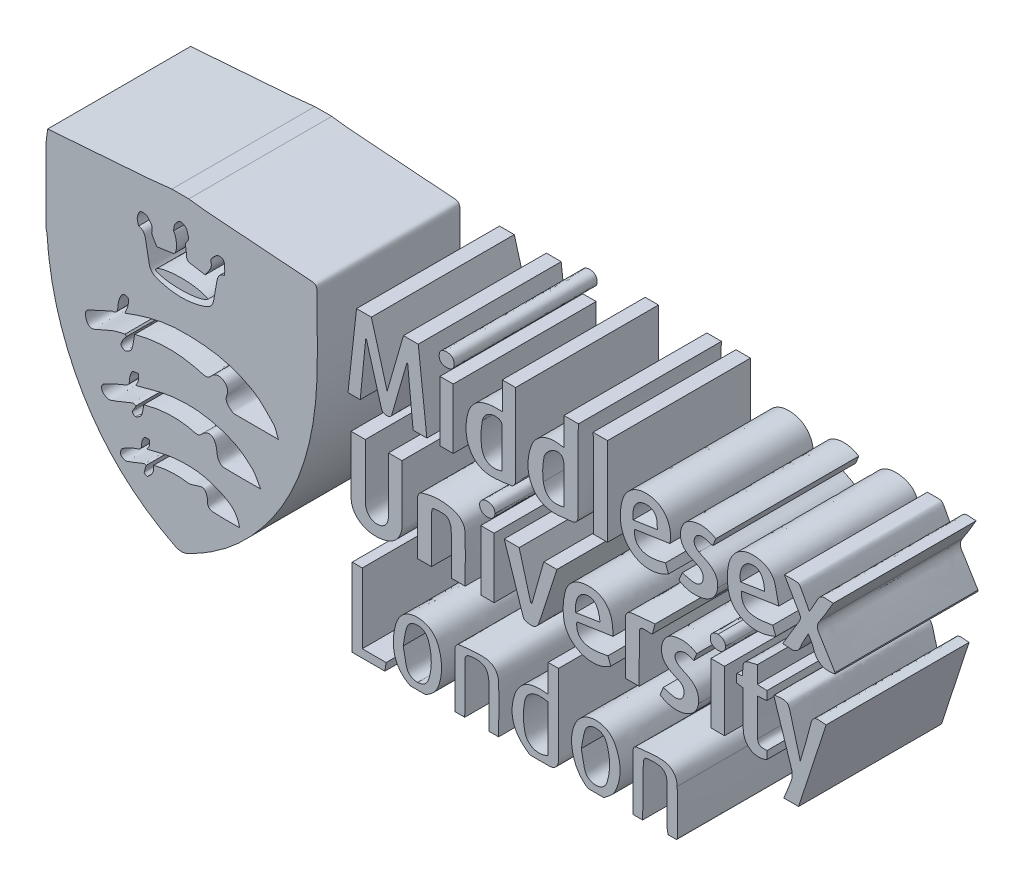
from build123d import *

# Parameters (mm, degrees)
BOSS_EXTRUDE1_DEPTH    = 10
BOSS_EXTRUDE1_2_DEPTH  = 10
BOSS_EXTRUDE1_3_DEPTH  = 10
BOSS_EXTRUDE1_4_DEPTH  = 10
BOSS_EXTRUDE1_5_DEPTH  = 10
BOSS_EXTRUDE1_6_DEPTH  = 10
BOSS_EXTRUDE1_7_DEPTH  = 10
BOSS_EXTRUDE1_8_DEPTH  = 10
BOSS_EXTRUDE1_9_DEPTH  = 10
BOSS_EXTRUDE1_10_DEPTH = 10
BOSS_EXTRUDE1_11_DEPTH = 10
BOSS_EXTRUDE1_12_DEPTH = 10
BOSS_EXTRUDE1_13_DEPTH = 10
BOSS_EXTRUDE1_14_DEPTH = 10
BOSS_EXTRUDE1_15_DEPTH = 10
BOSS_EXTRUDE1_16_DEPTH = 10
BOSS_EXTRUDE1_17_DEPTH = 10
BOSS_EXTRUDE1_18_DEPTH = 10
BOSS_EXTRUDE1_19_DEPTH = 10
BOSS_EXTRUDE1_20_DEPTH = 10
BOSS_EXTRUDE1_21_DEPTH = 10
BOSS_EXTRUDE1_22_DEPTH = 10
BOSS_EXTRUDE1_23_DEPTH = 10
BOSS_EXTRUDE1_24_DEPTH = 10
BOSS_EXTRUDE1_25_DEPTH = 10
BOSS_EXTRUDE1_26_DEPTH = 10
BOSS_EXTRUDE1_27_DEPTH = 10
BOSS_EXTRUDE1_28_DEPTH = 10
BOSS_EXTRUDE1_29_DEPTH = 10
BOSS_EXTRUDE1_30_DEPTH = 10


with BuildPart() as part:
    # Model → Boss-Extrude1 (new body)
    with BuildSketch(Plane.XY):
        with BuildLine():
            add(Edge.make_bspline(
                [(121.087444374, 108.853111084), (121.087444414, 110.574666531), (121.087444414, 112.296222302), (121.087444414, 114.017777749)],
                knots=[10, 10, 10, 10, 11, 11, 11, 11], degree=3))
            add(Edge.make_bspline(
                [(121.087444414, 114.017777749), (121.126156703, 114.316230139), (121.164868992, 114.61468261), (121.205362523, 114.926867447)],
                knots=[11, 11, 11, 11, 12, 12, 12, 12], degree=3))
            add(Edge.make_bspline(
                [(121.205362523, 114.926867447), (123.561551956, 115.102295934), (125.893613582, 115.272626542), (128.224986135, 115.451915845), (128.78209554, 115.4947592), (129.336908574, 115.567470433), (129.892777745, 115.626444426)],
                knots=[12, 12, 12, 12, 13, 13, 13, 14, 14, 14, 14], degree=3))
            add(Edge.make_bspline(
                [(129.892777745, 115.626444426), (130.287888641, 115.626444416), (130.683000183, 115.626444416), (131.078111078, 115.626444421)],
                knots=[14, 14, 14, 14, 15, 15, 15, 15], degree=3))
            add(Edge.make_bspline(
                [(121.087444374, 108.853111084), (121.114913637, 108.732908473), (121.159444188, 108.613807861), (121.167289538, 108.492337886), (121.28236394, 106.71063527), (121.608210592, 104.96879327), (122.205258613, 103.286198945), (123.64746354, 99.221791995), (126.193410528, 96.100176334), (130.07683111, 94.127703708), (130.40635234, 93.960332788), (130.68112239, 93.947318078), (131.026134277, 94.113996535), (132.764426752, 94.953785068), (134.273640832, 96.096502139), (135.568153548, 97.517801689), (138.532681898, 100.772685701), (139.848608035, 104.687118602), (140.035539777, 109.013749857), (140.114000104, 110.82971524), (140.037688225, 112.652159878), (140.044935844, 114.471606395), (140.046195457, 114.787715491), (139.953145581, 114.914672212), (139.618576856, 114.937674442), (137.228239556, 115.102014621), (134.839005548, 115.282789843), (132.450036381, 115.466338495), (131.991334406, 115.501581256), (131.535349319, 115.572164803), (131.078111078, 115.626444421)],
                knots=[43, 43, 43, 43, 44, 44, 44, 45, 45, 45, 46, 46, 46, 47, 47, 47, 48, 48, 48, 49, 49, 49, 50, 50, 50, 51, 51, 51, 52, 52, 52, 53, 53, 53, 53], degree=3))
        make_face()
        with BuildLine():
            add(Edge.make_bspline(
                [(134.626227838, 97.482675926), (134.502898156, 98.093903476), (134.227126875, 98.462578646), (133.619716923, 98.793776777), (132.505693191, 99.401212567), (131.296165598, 99.547906456), (130.058348388, 99.410245608), (129.442081741, 99.341708448), (128.839034571, 99.154301282), (128.149388036, 99.002975893)],
                knots=[0, 0, 0, 0, 1, 1, 1, 2, 2, 2, 3, 3, 3, 3], degree=3))
            add(Edge.make_bspline(
                [(128.149388036, 99.002975893), (128.229692566, 99.137785494), (128.308150309, 99.21763075), (128.323549886, 99.308197573), (128.343760539, 99.427061119), (128.314269445, 99.554375053), (128.306154307, 99.678054842)],
                knots=[3, 3, 3, 3, 4, 4, 4, 5, 5, 5, 5], degree=3))
            add(Edge.make_bspline(
                [(128.306154307, 99.678054842), (128.180658091, 99.653401308), (127.997254558, 99.670729708), (127.942303131, 99.594932009), (127.842726522, 99.457583804), (127.779322769, 99.265835818), (127.774677058, 99.094791995), (127.768512706, 98.867858818), (127.730835419, 98.758426221), (127.479122101, 98.682075584), (127.116650686, 98.572126223), (126.767712683, 98.392010602), (126.445350576, 98.190171501), (126.341930209, 98.125417056), (126.266324036, 97.865244306), (126.314377951, 97.752724042), (126.360900305, 97.643793999), (126.608489843, 97.523986066), (126.723153387, 97.558250125), (127.140589793, 97.682987989), (127.53770961, 97.874589989), (127.947119375, 98.028677483), (128.000979782, 98.048950147), (128.081671239, 97.997930005), (128.096948731, 97.993901828)],
                knots=[5, 5, 5, 5, 6, 6, 6, 7, 7, 7, 8, 8, 8, 9, 9, 9, 10, 10, 10, 11, 11, 11, 12, 12, 12, 13, 13, 13, 13], degree=3))
            add(Edge.make_bspline(
                [(128.096948731, 97.993901828), (128.03927977, 97.798570081), (127.977921112, 97.640900119), (127.957448202, 97.478088351), (127.953465887, 97.446413282), (128.15527269, 97.338873334), (128.182519089, 97.361639387), (128.32460021, 97.480355655), (128.472206833, 97.613489647), (128.556235942, 97.773903628), (128.621709335, 97.898893415), (128.596941467, 98.07115551), (128.615136093, 98.250608381)],
                knots=[13, 13, 13, 13, 14, 14, 14, 15, 15, 15, 16, 16, 16, 17, 17, 17, 17], degree=3))
            add(Edge.make_bspline(
                [(128.615136093, 98.250608381), (129.40301888, 98.460332013), (130.204298782, 98.523943118), (131.025103978, 98.385278455), (131.17666191, 98.359672783), (131.347807149, 98.448779747), (131.509696492, 98.485880842), (131.715678105, 98.533088554), (131.984793461, 98.68247866), (132.11123148, 98.603342664), (132.268621098, 98.504833173), (132.398035679, 98.20924398), (132.379003249, 98.014445793), (132.344360661, 97.659888624), (132.549747349, 97.513167605), (132.788462752, 97.496513583), (133.388251723, 97.454668592), (133.992913781, 97.482675926), (134.626227838, 97.482675926)],
                knots=[17, 17, 17, 17, 18, 18, 18, 19, 19, 19, 20, 20, 20, 21, 21, 21, 22, 22, 22, 23, 23, 23, 23], degree=3))
        make_face(mode=Mode.SUBTRACT)
        with BuildLine():
            add(Edge.make_bspline(
                [(133.565412744, 112.223023281), (133.577364211, 112.347459161), (133.602694706, 112.453923593), (133.594286951, 112.557653373), (133.5786277, 112.750863156), (133.592687565, 112.974090163), (133.497473738, 113.122762451), (133.441448734, 113.210241608), (133.14582466, 113.2522082), (133.051489333, 113.18444554), (132.862909113, 113.048984009), (132.576160466, 112.772378315), (132.616583063, 112.645047263), (132.773645827, 112.150289026), (132.38765776, 111.933353624), (132.224461003, 111.59360369)],
                knots=[0, 0, 0, 0, 1, 1, 1, 2, 2, 2, 3, 3, 3, 4, 4, 4, 5, 5, 5, 5], degree=3))
            add(Edge.make_bspline(
                [(132.224461003, 111.59360369), (131.960143803, 111.643454653), (131.71488358, 111.702972984), (131.466065434, 111.73302509), (131.200840021, 111.765058664), (130.909071009, 111.724825009), (130.914342005, 112.134151768), (130.917716476, 112.396195205), (130.77560112, 112.765522145), (130.900030217, 112.898802446), (131.164598693, 113.182190671), (131.016878382, 113.431779926), (130.947447865, 113.661959675), (130.905964609, 113.799486326), (130.661242467, 113.965295488), (130.517158238, 113.957010464), (130.373982223, 113.948777762), (130.210755106, 113.758805508), (130.11550769, 113.610514495), (130.035161819, 113.48542297), (130.039639582, 113.305848498), (130.006592504, 113.15038625)],
                knots=[5, 5, 5, 5, 6, 6, 6, 7, 7, 7, 8, 8, 8, 9, 9, 9, 10, 10, 10, 11, 11, 11, 12, 12, 12, 12], degree=3))
            add(Edge.make_bspline(
                [(130.006592504, 113.15038625), (130.23630458, 112.877628997), (130.297586369, 112.101639864), (130.100027369, 111.849692387), (130.062904312, 111.80234967), (129.983978897, 111.773967681), (129.920046753, 111.763770952), (129.576821579, 111.709025909), (129.232238607, 111.662799402), (128.842297292, 111.607083488)],
                knots=[12, 12, 12, 12, 13, 13, 13, 14, 14, 14, 15, 15, 15, 15], degree=3))
            add(Edge.make_bspline(
                [(128.842297292, 111.607083488), (128.715246908, 111.865751161), (128.434695557, 112.168840865), (128.492972361, 112.377129185), (128.596914983, 112.748631057), (128.35341951, 112.897596124), (128.20376327, 113.081164377), (128.117886083, 113.186501939), (127.82184343, 113.230074538), (127.69548551, 113.162034925), (127.56897579, 113.093913599), (127.501259639, 112.857951903), (127.47290801, 112.684888177), (127.450528239, 112.548279268), (127.526952515, 112.395483685), (127.565231832, 112.2242141)],
                knots=[15, 15, 15, 15, 16, 16, 16, 17, 17, 17, 18, 18, 18, 19, 19, 19, 20, 20, 20, 20], degree=3))
            add(Edge.make_bspline(
                [(127.565231832, 112.2242141), (127.928936376, 112.177447575), (128.019369487, 111.887637099), (128.075623159, 111.568197618), (128.141552597, 111.193804127), (128.227847717, 110.822277063), (128.276666443, 110.445792615), (128.325430908, 110.069718994), (128.510149607, 109.815367594), (128.862500839, 109.691629023), (129.992700587, 109.294728831), (131.126869084, 109.295825017), (132.256819493, 109.689238988), (132.587287693, 109.804297856), (132.78218665, 110.036638326), (132.827646407, 110.403754806), (132.87601684, 110.79436856), (132.966953149, 111.179560811), (133.033272099, 111.568148849), (133.088291996, 111.890530334), (133.185174971, 112.174833393), (133.565412744, 112.223023281)],
                knots=[20, 20, 20, 20, 21, 21, 21, 22, 22, 22, 23, 23, 23, 24, 24, 24, 25, 25, 25, 26, 26, 26, 27, 27, 27, 27], degree=3))
        make_face(mode=Mode.SUBTRACT)
        with BuildLine():
            add(Edge.make_bspline(
                [(127.924073624, 101.582565208), (129.069023763, 101.88711251), (130.245702586, 102.016667909), (131.435434229, 101.687702201), (131.66623797, 101.623884391), (131.818343673, 101.635394024), (131.986706781, 101.828272432), (132.193478398, 102.065150738), (132.518454686, 102.215399965), (132.770250686, 101.997457196), (132.944667688, 101.846488374), (133.026024479, 101.523059796), (133.041589421, 101.270081697), (133.060701949, 100.959462414), (133.225812026, 100.582186993), (133.534170465, 100.570497784), (134.342356276, 100.539862703), (135.152473494, 100.560161206), (136.10441668, 100.560161206)],
                knots=[0, 0, 0, 0, 1, 1, 1, 2, 2, 2, 3, 3, 3, 4, 4, 4, 5, 5, 5, 6, 6, 6, 6], degree=3))
            add(Edge.make_bspline(
                [(136.10441668, 100.560161206), (135.867922072, 100.950906089), (135.747964277, 101.284367647), (135.517464135, 101.499261507), (135.141405694, 101.84985897), (134.72932232, 102.200703188), (134.268904687, 102.414839988), (132.717301721, 103.136479402), (131.077167983, 103.300527528), (129.399526845, 102.977597627), (128.746624837, 102.851919252), (128.107643814, 102.653921002), (127.359960124, 102.462683321)],
                knots=[6, 6, 6, 6, 7, 7, 7, 8, 8, 8, 9, 9, 9, 10, 10, 10, 10], degree=3))
            add(Edge.make_bspline(
                [(127.359960124, 102.462683321), (127.45431483, 102.648046683), (127.532425695, 102.743779858), (127.549571289, 102.849411653), (127.572345739, 102.989713167), (127.54756689, 103.137732555), (127.543220256, 103.282436901)],
                knots=[10, 10, 10, 10, 11, 11, 11, 12, 12, 12, 12], degree=3))
            add(Edge.make_bspline(
                [(127.543220256, 103.282436901), (127.396006373, 103.249238669), (127.182086614, 103.263873435), (127.116375509, 103.172234325), (127.002582067, 103.013539878), (126.939598832, 102.790823498), (126.930715653, 102.591597932), (126.920035426, 102.352049247), (126.875051092, 102.220928051), (126.621387635, 102.125657381), (126.130372709, 101.941239697), (125.655202424, 101.709548413), (125.187677021, 101.469741345), (124.939248386, 101.342316306), (124.917057234, 101.078999046), (125.0772939, 100.891940696), (125.186176143, 100.764832176), (125.444567994, 100.642016675), (125.582779842, 100.685759483), (126.112609582, 100.853444338), (126.619131313, 101.093787549), (127.13938767, 101.293925203), (127.206700745, 101.319820263), (127.303453883, 101.269185111), (127.396205974, 101.252239117)],
                knots=[12, 12, 12, 12, 13, 13, 13, 14, 14, 14, 15, 15, 15, 16, 16, 16, 17, 17, 17, 18, 18, 18, 19, 19, 19, 20, 20, 20, 20], degree=3))
            add(Edge.make_bspline(
                [(127.396205974, 101.252239117), (127.36725942, 101.184982241), (127.359166245, 101.157885703), (127.34494812, 101.134515037), (127.265503357, 101.003920941), (127.165741359, 100.880586092), (127.118109899, 100.7395146), (127.106942622, 100.706442975), (127.300257696, 100.542735913), (127.348099737, 100.562644259), (127.504741338, 100.627826326), (127.698255366, 100.72019149), (127.765526454, 100.857152122), (127.865913737, 101.061536287), (127.870910202, 101.312776766), (127.924073624, 101.582565208)],
                knots=[20, 20, 20, 20, 21, 21, 21, 22, 22, 22, 23, 23, 23, 24, 24, 24, 25, 25, 25, 25], degree=3))
        make_face(mode=Mode.SUBTRACT)
        with BuildLine():
            add(Edge.make_bspline(
                [(126.602764741, 106.467627493), (126.697261557, 106.694191183), (126.772961716, 106.825289124), (126.80529243, 106.966329611), (126.843238434, 107.131863434), (126.921315064, 107.371764811), (126.844215119, 107.463049937), (126.673295965, 107.665415492), (126.423245337, 107.567349772), (126.319502961, 107.36335318), (126.203556873, 107.135359991), (126.13101059, 106.866264659), (126.116926179, 106.610792527), (126.102513622, 106.349373083), (126.058336409, 106.179310466), (125.766765382, 106.152330201), (125.687889059, 106.145031551), (125.611050403, 106.100638266), (125.536261041, 106.066694601), (125.068871288, 105.85457189), (124.60836096, 105.625790635), (124.133497827, 105.432134497), (123.785634693, 105.290269771), (123.813309683, 105.023803478), (123.890973548, 104.766423839), (123.970060774, 104.504326142), (124.168106179, 104.308044842), (124.467757463, 104.421178763), (124.906312735, 104.586753928), (125.322160414, 104.812179444), (125.759868516, 104.98039915), (126.037316051, 105.087028301), (126.336894987, 105.136070527), (126.626548819, 105.210938696)],
                knots=[0, 0, 0, 0, 1, 1, 1, 2, 2, 2, 3, 3, 3, 4, 4, 4, 5, 5, 5, 6, 6, 6, 7, 7, 7, 8, 8, 8, 9, 9, 9, 10, 10, 10, 11, 11, 11, 11], degree=3))
            add(Edge.make_bspline(
                [(126.626548819, 105.210938696), (126.656370642, 105.173125759), (126.686192465, 105.135312821), (126.716014934, 105.097499884)],
                knots=[11, 11, 11, 11, 12, 12, 12, 12], degree=3))
            add(Edge.make_bspline(
                [(126.716014934, 105.097499884), (126.629395544, 104.987252091), (126.52780097, 104.885329372), (126.460533112, 104.764323192), (126.398133174, 104.652072938), (126.313601835, 104.499219219), (126.347206373, 104.401528799), (126.380189502, 104.305645763), (126.571878383, 104.179754223), (126.654507706, 104.20359902), (126.814390712, 104.249739615), (127.023626648, 104.363181011), (127.074533102, 104.500020204), (127.187570776, 104.803872458), (127.215498012, 105.139386862), (127.290423025, 105.525356197)],
                knots=[12, 12, 12, 12, 13, 13, 13, 14, 14, 14, 15, 15, 15, 16, 16, 16, 17, 17, 17, 17], degree=3))
            add(Edge.make_bspline(
                [(127.290423025, 105.525356197), (128.791509694, 105.92586728), (130.3734829, 105.98988469), (131.954638971, 105.524648876), (132.236207056, 105.441801865), (132.431771346, 105.414808681), (132.645055485, 105.671161251), (132.840610732, 105.906205043), (133.133827976, 106.033507996), (133.442563653, 105.871006287), (133.765038802, 105.70127117), (133.859543369, 105.367099707), (133.744397943, 105.069820695), (133.583179101, 104.653594809), (133.824176019, 104.472782848), (134.075103855, 104.267109356), (134.125634362, 104.225691987), (134.199185429, 104.18996161), (134.262306899, 104.189656719), (135.257690586, 104.18485727), (136.253103987, 104.186287416), (137.345259545, 104.186287416)],
                knots=[17, 17, 17, 17, 18, 18, 18, 19, 19, 19, 20, 20, 20, 21, 21, 21, 22, 22, 22, 23, 23, 23, 24, 24, 24, 24], degree=3))
            add(Edge.make_bspline(
                [(137.345259545, 104.186287416), (137.213128075, 104.493042593), (137.168664381, 104.769986929), (137.008667687, 104.934715892), (136.552588291, 105.404284776), (136.10577577, 105.922401083), (135.554102726, 106.252015331), (134.019445754, 107.168939336), (132.295789982, 107.376373057), (130.541829859, 107.349874675), (129.216837738, 107.329857809), (127.955417964, 106.97874229), (126.602764741, 106.467627493)],
                knots=[24, 24, 24, 24, 25, 25, 25, 26, 26, 26, 27, 27, 27, 28, 28, 28, 28], degree=3))
        make_face(mode=Mode.SUBTRACT)
    extrude(amount=BOSS_EXTRUDE1_DEPTH)


with BuildPart() as body_2:
    # Model → Boss-Extrude1 2 (new body)
    with BuildSketch(Plane.XY):
        with BuildLine():
            add(Edge.make_bspline(
                [(128.72691157, 110.172407816), (129.40484758, 109.709309468), (131.846932367, 109.7305136), (132.429378727, 110.226493662)],
                knots=[1, 1, 1, 1, 2, 2, 2, 2], degree=3))
            add(Edge.make_bspline(
                [(132.429378727, 110.226493662), (131.679301772, 110.725736445), (129.086672557, 110.674040311), (128.72691157, 110.172407816)],
                knots=[0, 0, 0, 0, 1, 1, 1, 1], degree=3))
        make_face()
    extrude(amount=BOSS_EXTRUDE1_2_DEPTH)


with BuildPart() as body_3:
    # Model → Boss-Extrude1 3 (new body)
    with BuildSketch(Plane.XY):
        with BuildLine():
            add(Edge.make_bspline(
                [(142.426276277, 107.219467906), (142.426276277, 105.831616573), (142.391259035, 104.466987336), (142.439838757, 103.105341768), (142.467534741, 102.329076489), (143.180088146, 101.763698854), (144.005404695, 101.728380597), (145.056722952, 101.683389803), (145.78004831, 102.136663169), (145.962579804, 102.9567281), (145.977801097, 103.02511669), (145.987741059, 103.096302268), (145.987818574, 103.166202394), (145.989281017, 104.503956656), (145.988898611, 105.841711564), (145.988898611, 107.219161723)],
                knots=[9, 9, 9, 9, 10, 10, 10, 11, 11, 11, 12, 12, 12, 13, 13, 13, 14, 14, 14, 14], degree=3))
            add(Edge.make_bspline(
                [(145.988898611, 107.219161723), (145.654867321, 107.219161723), (145.367685884, 107.219161723), (145.048434053, 107.219161723)],
                knots=[0, 0, 0, 0, 1, 1, 1, 1], degree=3))
            add(Edge.make_bspline(
                [(145.048434053, 107.219161723), (145.048434053, 107.042422511), (145.048441804, 106.890255443), (145.048434053, 106.738088374), (145.048379792, 105.610953039), (145.054387178, 104.48377055), (145.045488496, 103.356704978), (145.041532665, 102.855827282), (144.734737438, 102.527560498), (144.28846752, 102.505583803), (143.827743705, 102.482895265), (143.484180696, 102.806376812), (143.439147269, 103.313052603), (143.425458182, 103.467070334), (143.425853507, 103.622642233), (143.425685558, 103.77750875), (143.424590018, 104.777840455), (143.425127453, 105.778173452), (143.425127453, 106.778505804), (143.425127453, 106.926837189), (143.425127453, 107.075168574), (143.425127453, 107.219467906)],
                knots=[1, 1, 1, 1, 2, 2, 2, 3, 3, 3, 4, 4, 4, 5, 5, 5, 6, 6, 6, 7, 7, 7, 8, 8, 8, 8], degree=3))
            add(Edge.make_bspline(
                [(143.425127453, 107.219467906), (143.054142346, 107.219467906), (142.749545951, 107.219467906), (142.426276277, 107.219467906)],
                knots=[8, 8, 8, 8, 9, 9, 9, 9], degree=3))
        make_face()
    extrude(amount=BOSS_EXTRUDE1_3_DEPTH)


with BuildPart() as body_4:
    # Model → Boss-Extrude1 4 (new body)
    with BuildSketch(Plane.XY):
        with BuildLine():
            add(Edge.make_bspline(
                [(149.451118805, 101.827346132), (149.799872711, 101.827346132), (150.079576568, 101.827346132), (150.411825022, 101.827346132)],
                knots=[14, 14, 14, 14, 15, 15, 15, 15], degree=3))
            add(Edge.make_bspline(
                [(150.411825022, 101.827346132), (150.411825022, 102.939212373), (150.438086985, 104.008371919), (150.400864451, 105.075317129), (150.381945709, 105.617654827), (149.990842967, 105.927357499), (149.487315562, 106.053834921), (148.758822561, 106.236818584), (148.030016917, 106.173014339), (147.32553537, 105.935295645), (147.208227285, 105.895712144), (147.08133839, 105.67889915), (147.077873485, 105.540991547), (147.055575104, 104.654120617), (147.066411652, 103.766416403), (147.066378062, 102.878986075), (147.066365143, 102.532620912), (147.066375479, 102.186255749), (147.066375479, 101.830188336)],
                knots=[0, 0, 0, 0, 1, 1, 1, 2, 2, 2, 3, 3, 3, 4, 4, 4, 5, 5, 5, 6, 6, 6, 6], degree=3))
            add(Edge.make_bspline(
                [(147.066375479, 101.830188336), (147.418956025, 101.830188336), (147.710736664, 101.830188336), (148.053627879, 101.830188336)],
                knots=[6, 6, 6, 6, 7, 7, 7, 7], degree=3))
            add(Edge.make_bspline(
                [(148.053627879, 101.830188336), (148.053627879, 101.999088879), (148.053617544, 102.150776003), (148.053630463, 102.302463126), (148.053718313, 103.218066153), (148.049723725, 104.133706646), (148.058547475, 105.049226345), (148.059795461, 105.178615734), (148.111862051, 105.413873338), (148.160249278, 105.419178569), (148.47305189, 105.453478155), (148.817886139, 105.51126145), (149.097931061, 105.41048401), (149.266303212, 105.349893393), (149.425569977, 105.020454845), (149.435153371, 104.804999004), (149.473300913, 103.947433778), (149.451018036, 103.087180086), (149.451113637, 102.227922456), (149.45112914, 102.09498871), (149.451118805, 101.962053672), (149.451118805, 101.827346132)],
                knots=[7, 7, 7, 7, 8, 8, 8, 9, 9, 9, 10, 10, 10, 11, 11, 11, 12, 12, 12, 13, 13, 13, 14, 14, 14, 14], degree=3))
        make_face()
    extrude(amount=BOSS_EXTRUDE1_4_DEPTH)


with BuildPart() as body_5:
    # Model → Boss-Extrude1 5 (new body)
    with BuildSketch(Plane.XY):
        with BuildLine():
            add(Edge.make_bspline(
                [(143.069733125, 109.457003163), (143.199050813, 110.761575019), (143.32619034, 112.044175994), (143.453329866, 113.326777292)],
                knots=[15, 15, 15, 15, 16, 16, 16, 16], degree=3))
            add(Edge.make_bspline(
                [(143.453329866, 113.326777292), (143.47033658, 113.329286344), (143.48734071, 113.331795235), (143.50434484, 113.334304126)],
                knots=[0, 0, 0, 0, 1, 1, 1, 1], degree=3))
            add(Edge.make_bspline(
                [(143.50434484, 113.334304126), (143.839742972, 112.161270268), (144.179835908, 110.989541402), (144.506591157, 109.814105397), (144.572199556, 109.578087504), (144.625454703, 109.41482163), (144.93763203, 109.419769648), (145.240758231, 109.42457491), (145.266891002, 109.603414123), (145.326057934, 109.810807795), (145.660766185, 110.984009439), (146.001461152, 112.155503178), (146.340114899, 113.327578761)],
                knots=[1, 1, 1, 1, 2, 2, 2, 3, 3, 3, 4, 4, 4, 5, 5, 5, 5], degree=3))
            add(Edge.make_bspline(
                [(146.340114899, 113.327578761), (146.356413646, 113.325305321), (146.372712393, 113.323031719), (146.389008556, 113.320758118)],
                knots=[5, 5, 5, 5, 6, 6, 6, 6], degree=3))
            add(Edge.make_bspline(
                [(146.389008556, 113.320758118), (146.515840607, 112.038729621), (146.642670075, 110.756700963), (146.771057587, 109.4589378)],
                knots=[6, 6, 6, 6, 7, 7, 7, 7], degree=3))
            add(Edge.make_bspline(
                [(146.771057587, 109.4589378), (147.103396475, 109.4589378), (147.405455557, 109.4589378), (147.733143565, 109.4589378)],
                knots=[7, 7, 7, 7, 8, 8, 8, 8], degree=3))
            add(Edge.make_bspline(
                [(147.733143565, 109.4589378), (147.529928579, 111.274037925), (147.330018301, 113.059627416), (147.129679108, 114.849036441)],
                knots=[8, 8, 8, 8, 9, 9, 9, 9], degree=3))
            add(Edge.make_bspline(
                [(147.129679108, 114.849036441), (146.757588125, 114.849036441), (146.435868745, 114.849036441), (146.094633759, 114.849036441)],
                knots=[9, 9, 9, 9, 10, 10, 10, 10], degree=3))
            add(Edge.make_bspline(
                [(146.094633759, 114.849036441), (145.723165477, 113.568142242), (145.354089814, 112.295493987), (144.953060029, 110.912661081)],
                knots=[10, 10, 10, 10, 11, 11, 11, 11], degree=3))
            add(Edge.make_bspline(
                [(144.953060029, 110.912661081), (144.561574881, 112.309454698), (144.205498425, 113.579918494), (143.85031597, 114.847184245)],
                knots=[11, 11, 11, 11, 12, 12, 12, 12], degree=3))
            add(Edge.make_bspline(
                [(143.85031597, 114.847184245), (143.493645235, 114.847184245), (143.172716503, 114.847184245), (142.813960624, 114.847184245)],
                knots=[12, 12, 12, 12, 13, 13, 13, 13], degree=3))
            add(Edge.make_bspline(
                [(142.813960624, 114.847184245), (142.613569755, 113.04897658), (142.414580609, 111.263353177), (142.213282818, 109.457003163)],
                knots=[13, 13, 13, 13, 14, 14, 14, 14], degree=3))
            add(Edge.make_bspline(
                [(142.213282818, 109.457003163), (142.524498964, 109.457003163), (142.784365531, 109.457003163), (143.069733125, 109.457003163)],
                knots=[14, 14, 14, 14, 15, 15, 15, 15], degree=3))
        make_face()
    extrude(amount=BOSS_EXTRUDE1_5_DEPTH)


with BuildPart() as body_6:
    # Model → Boss-Extrude1 6 (new body)
    with BuildSketch(Plane.XY):
        with BuildLine():
            add(Edge.make_bspline(
                [(148.646754466, 109.449668986), (148.966293101, 109.449668986), (149.257518219, 109.449668986), (149.577416005, 109.449668986)],
                knots=[3, 3, 3, 3, 4, 4, 4, 4], degree=3))
            add(Edge.make_bspline(
                [(149.577416005, 109.449668986), (149.577416005, 110.886266375), (149.577416005, 112.272070675), (149.577416005, 113.65873555)],
                knots=[0, 0, 0, 0, 1, 1, 1, 1], degree=3))
            add(Edge.make_bspline(
                [(149.577416005, 113.65873555), (149.248505849, 113.65873555), (148.948425975, 113.65873555), (148.646754466, 113.65873555)],
                knots=[1, 1, 1, 1, 2, 2, 2, 2], degree=3))
            add(Edge.make_bspline(
                [(148.646754466, 113.65873555), (148.646754466, 112.238631179), (148.646754466, 110.852823649), (148.646754466, 109.449668986)],
                knots=[2, 2, 2, 2, 3, 3, 3, 3], degree=3))
        make_face()
    extrude(amount=BOSS_EXTRUDE1_6_DEPTH)


with BuildPart() as body_7:
    # Model → Boss-Extrude1 7 (new body)
    with BuildSketch(Plane.XY):
        with BuildLine():
            add(Edge.make_bspline(
                [(153.00677774, 115.626444416), (153.317221323, 115.626444416), (153.62766749, 115.626444416), (153.938111073, 115.626444416)],
                knots=[6, 6, 6, 6, 7, 7, 7, 7], degree=3))
            add(Edge.make_bspline(
                [(150.490794362, 111.815519731), (150.354632131, 110.574993708), (150.898115753, 109.584913961), (151.920996469, 109.427398381), (152.486088592, 109.340378499), (153.088793405, 109.46342073), (153.66871408, 109.537448512), (153.777206165, 109.551297149), (153.938604583, 109.781296676), (153.939511504, 109.912486989), (153.952670907, 111.817045155), (153.942614674, 113.721764002), (153.938111073, 115.626444416)],
                knots=[56, 56, 56, 56, 57, 57, 57, 58, 58, 58, 59, 59, 59, 60, 60, 60, 60], degree=3))
            add(Edge.make_bspline(
                [(153.00677774, 113.701216807), (151.368885467, 113.788434836), (150.645854665, 113.228175429), (150.490794362, 111.815519731)],
                knots=[55, 55, 55, 55, 56, 56, 56, 56], degree=3))
            add(Edge.make_bspline(
                [(153.00677774, 115.626444416), (153.00677774, 114.985544663), (153.00677774, 114.34464491), (153.00677774, 113.701216807)],
                knots=[54, 54, 54, 54, 55, 55, 55, 55], degree=3))
        make_face()
        with BuildLine():
            add(Edge.make_bspline(
                [(152.990564259, 110.088290858), (152.990564259, 111.029502787), (152.996186655, 111.985062031), (152.97982848, 112.940245653), (152.978528818, 113.016205648), (152.83501303, 113.136187504), (152.740641529, 113.156336952), (152.237783335, 113.263704914), (151.711011871, 112.983667421), (151.608961252, 112.448751751)],
                knots=[0, 0, 0, 0, 1, 1, 1, 2, 2, 2, 3, 3, 3, 3], degree=3))
            add(Edge.make_bspline(
                [(151.608961252, 112.448751751), (151.508590118, 111.92264982), (151.480640919, 111.354889902), (151.564333485, 110.828198537), (151.682602752, 110.083892547), (152.224843556, 109.833173355), (152.990564259, 110.088290858)],
                knots=[3, 3, 3, 3, 4, 4, 4, 5, 5, 5, 5], degree=3))
        make_face(mode=Mode.SUBTRACT)
    extrude(amount=BOSS_EXTRUDE1_7_DEPTH)


with BuildPart() as body_8:
    # Model → Boss-Extrude1 8 (new body)
    with BuildSketch(Plane.XY):
        with BuildLine():
            add(Edge.make_bspline(
                [(157.324777738, 115.626444416), (157.663444405, 115.626444416), (158.002111072, 115.626444416), (158.340777738, 115.626444395)],
                knots=[9, 9, 9, 9, 10, 10, 10, 10], degree=3))
            add(Edge.make_bspline(
                [(154.8134995, 111.581827277), (154.729509795, 110.414211209), (155.375945789, 109.494495061), (156.394263477, 109.3858234), (156.874407296, 109.334585571), (157.372767057, 109.4233069), (157.859693408, 109.477280995), (158.179715218, 109.512754282), (158.31372771, 109.69054188), (158.30842054, 110.051144546), (158.284987862, 111.64369301), (158.296374764, 113.236786984), (158.300227242, 114.829671264), (158.30086803, 115.095293414), (158.326626147, 115.360854845), (158.340777738, 115.626444395)],
                knots=[65, 65, 65, 65, 66, 66, 66, 67, 67, 67, 68, 68, 68, 69, 69, 69, 70, 70, 70, 70], degree=3))
            add(Edge.make_bspline(
                [(157.324777738, 113.677329376), (157.135554146, 113.701681895), (156.99694762, 113.723233551), (156.857565947, 113.736843993), (156.06970706, 113.813776151), (155.347875151, 113.419804236), (155.053833668, 112.687627351), (154.91492225, 112.341736643), (154.840373829, 111.955377797), (154.8134995, 111.581827277)],
                knots=[62, 62, 62, 62, 63, 63, 63, 64, 64, 64, 65, 65, 65, 65], degree=3))
            add(Edge.make_bspline(
                [(157.324777738, 115.626444416), (157.324777738, 114.983148168), (157.324777738, 114.339851921), (157.324777738, 113.677329376)],
                knots=[61, 61, 61, 61, 62, 62, 62, 62], degree=3))
        make_face()
        with BuildLine():
            add(Edge.make_bspline(
                [(157.325105884, 110.079504572), (157.325105884, 110.911531305), (157.325129138, 111.728090959), (157.325095549, 112.544650613), (157.325067126, 113.174093943), (157.000006865, 113.385963924), (156.443219145, 113.055543363), (156.212328845, 112.918524433), (155.970299691, 112.638197229), (155.923519601, 112.387544247), (155.832545826, 111.900129877), (155.802948149, 111.376110829), (155.880199248, 110.888195197)],
                knots=[0, 0, 0, 0, 1, 1, 1, 2, 2, 2, 3, 3, 3, 4, 4, 4, 4], degree=3))
            add(Edge.make_bspline(
                [(155.880199248, 110.888195197), (156.003811857, 110.107425994), (156.509292631, 109.845859919), (157.325105884, 110.079504572)],
                knots=[4, 4, 4, 4, 5, 5, 5, 5], degree=3))
        make_face(mode=Mode.SUBTRACT)
    extrude(amount=BOSS_EXTRUDE1_8_DEPTH)


with BuildPart() as body_9:
    # Model → Boss-Extrude1 9 (new body)
    with BuildSketch(Plane.XY):
        with BuildLine():
            add(Edge.make_bspline(
                [(159.356777738, 115.626444385), (159.695444405, 115.626444416), (160.034111071, 115.626444416), (160.372777738, 115.626444416)],
                knots=[5, 5, 5, 5, 6, 6, 6, 6], degree=3))
            add(Edge.make_bspline(
                [(160.372777738, 109.465442571), (160.372777738, 111.541308756), (160.372777738, 113.583876586), (160.372777738, 115.626444416)],
                knots=[75, 75, 75, 75, 76, 76, 76, 76], degree=3))
            add(Edge.make_bspline(
                [(159.399240262, 109.465442571), (159.750053474, 109.465442571), (160.050378812, 109.465442571), (160.372777738, 109.465442571)],
                knots=[74, 74, 74, 74, 75, 75, 75, 75], degree=3))
            add(Edge.make_bspline(
                [(159.356777738, 115.626444385), (159.370926745, 115.459523584), (159.397080187, 115.292623868), (159.397374743, 115.125678834), (159.400395231, 113.40586468), (159.399232511, 111.686042815), (159.399237679, 109.966223373), (159.399237679, 109.80031102), (159.399240262, 109.634398666), (159.399240262, 109.465442571)],
                knots=[71, 71, 71, 71, 72, 72, 72, 73, 73, 73, 74, 74, 74, 74], degree=3))
        make_face()
    extrude(amount=BOSS_EXTRUDE1_9_DEPTH)


with BuildPart() as body_10:
    # Model → Boss-Extrude1 10 (new body)
    with BuildSketch(Plane.XY):
        with BuildLine():
            add(Edge.make_bspline(
                [(162.277777737, 111.205985231), (163.092720242, 111.327589566), (163.912174099, 111.449867309), (164.729772772, 111.571867937)],
                knots=[6, 6, 6, 6, 7, 7, 7, 7], degree=3))
            add(Edge.make_bspline(
                [(164.729772772, 111.571867937), (164.955293891, 112.553100033), (164.451376329, 113.496374982), (163.587434231, 113.717328065), (162.564605191, 113.978916588), (161.663156338, 113.486563081), (161.388658882, 112.476649919), (161.294359728, 112.129711471), (161.257369738, 111.753518671), (161.270304349, 111.393424049), (161.334452888, 109.607652237), (163.060311367, 108.721209574), (164.639860948, 109.680508901)],
                knots=[0, 0, 0, 0, 1, 1, 1, 2, 2, 2, 3, 3, 3, 4, 4, 4, 4], degree=3))
            add(Edge.make_bspline(
                [(164.639860948, 109.680508901), (164.569332953, 109.866520157), (164.496722398, 110.058022033), (164.424959337, 110.247285675)],
                knots=[4, 4, 4, 4, 5, 5, 5, 5], degree=3))
            add(Edge.make_bspline(
                [(164.424959337, 110.247285675), (162.983884508, 109.809199366), (162.141974657, 110.18831576), (162.277777737, 111.205985231)],
                knots=[5, 5, 5, 5, 6, 6, 6, 6], degree=3))
        make_face()
        with BuildLine():
            add(Edge.make_bspline(
                [(163.855640082, 111.978302754), (163.858358263, 112.459157447), (163.841421312, 112.909533057), (163.386862494, 113.069040924), (163.149194831, 113.152440872), (162.777189114, 113.113187777), (162.571733955, 112.973548529)],
                knots=[0, 0, 0, 0, 1, 1, 1, 2, 2, 2, 2], degree=3))
            add(Edge.make_bspline(
                [(162.571733955, 112.973548529), (162.155730923, 112.690817725), (162.127066006, 112.213817448), (162.157965929, 111.713046981)],
                knots=[2, 2, 2, 2, 3, 3, 3, 3], degree=3))
            add(Edge.make_bspline(
                [(162.157965929, 111.713046981), (162.750611925, 111.805645657), (163.288687608, 111.889718368), (163.855640082, 111.978302754)],
                knots=[3, 3, 3, 3, 4, 4, 4, 4], degree=3))
        make_face(mode=Mode.SUBTRACT)
    extrude(amount=BOSS_EXTRUDE1_10_DEPTH)


with BuildPart() as body_11:
    # Model → Boss-Extrude1 11 (new body)
    with BuildSketch(Plane.XY):
        with BuildLine():
            add(Edge.make_bspline(
                [(165.603192328, 110.239644668), (165.527636216, 110.059951502), (165.452121446, 109.880341664), (165.362617865, 109.667473521)],
                knots=[15, 15, 15, 15, 16, 16, 16, 16], degree=3))
            add(Edge.make_bspline(
                [(165.362617865, 109.667473521), (165.895236517, 109.342829254), (166.43616474, 109.292990565), (166.986467067, 109.40278748), (167.606801295, 109.526558349), (168.022584702, 109.986241531), (168.074473008, 110.541864593)],
                knots=[0, 0, 0, 0, 1, 1, 1, 2, 2, 2, 2], degree=3))
            add(Edge.make_bspline(
                [(168.074473008, 110.541864593), (168.129032985, 111.126038884), (167.871312282, 111.532682344), (167.255427394, 111.832646593), (167.091189357, 111.912636865), (166.92063646, 111.981322918), (166.76250141, 112.071823531)],
                knots=[2, 2, 2, 2, 3, 3, 3, 4, 4, 4, 4], degree=3))
            add(Edge.make_bspline(
                [(166.76250141, 112.071823531), (166.484657904, 112.230825777), (166.359290879, 112.470157098), (166.478498073, 112.782153558), (166.592108709, 113.079493936), (166.848201605, 113.157956201), (167.135238348, 113.111580317), (167.334740382, 113.079346335), (167.526940537, 113.001919052), (167.73587352, 112.940737548)],
                knots=[4, 4, 4, 4, 5, 5, 5, 6, 6, 6, 7, 7, 7, 7], degree=3))
            add(Edge.make_bspline(
                [(167.73587352, 112.940737548), (167.808246364, 113.12309964), (167.873921942, 113.288587116), (167.945783188, 113.469663596)],
                knots=[7, 7, 7, 7, 8, 8, 8, 8], degree=3))
            add(Edge.make_bspline(
                [(167.945783188, 113.469663596), (167.433261501, 113.785899946), (166.914755682, 113.850656652), (166.378741888, 113.706049038), (165.849823269, 113.563357651), (165.552223863, 113.192018883), (165.477520412, 112.650929656), (165.41080097, 112.167651338), (165.652357286, 111.738412035), (166.135201198, 111.479025736), (166.308229396, 111.386073722), (166.492719427, 111.314599726), (166.671075466, 111.231384844), (167.00001146, 111.077912945), (167.136421738, 110.810761616), (167.038034979, 110.47085084)],
                knots=[8, 8, 8, 8, 9, 9, 9, 10, 10, 10, 11, 11, 11, 12, 12, 12, 13, 13, 13, 13], degree=3))
            add(Edge.make_bspline(
                [(167.038034979, 110.47085084), (166.941617092, 110.137721303), (166.658290716, 110.022082367), (166.337276719, 110.059426986), (166.094795396, 110.087635213), (165.859145697, 110.174494252), (165.603192328, 110.239644668)],
                knots=[13, 13, 13, 13, 14, 14, 14, 15, 15, 15, 15], degree=3))
        make_face()
    extrude(amount=BOSS_EXTRUDE1_11_DEPTH)


with BuildPart() as body_12:
    # Model → Boss-Extrude1 12 (new body)
    with BuildSketch(Plane.XY):
        with BuildLine():
            add(Edge.make_bspline(
                [(169.732656031, 111.202228355), (170.564052312, 111.325810282), (171.398952255, 111.449912526), (172.356159978, 111.592195508)],
                knots=[8, 8, 8, 8, 9, 9, 9, 9], degree=3))
            add(Edge.make_bspline(
                [(172.356159978, 111.592195508), (172.252750269, 112.054603975), (172.195286076, 112.485447832), (172.0560646, 112.888014345), (171.89865302, 113.343172447), (171.531450627, 113.60496057), (171.061691187, 113.720984011), (170.001053085, 113.982951225), (169.085124497, 113.441933376), (168.843924749, 112.379808285)],
                knots=[0, 0, 0, 0, 1, 1, 1, 2, 2, 2, 3, 3, 3, 3], degree=3))
            add(Edge.make_bspline(
                [(168.843924749, 112.379808285), (168.773107366, 112.067982357), (168.753987086, 111.737709881), (168.7591754, 111.416667462), (168.771675929, 110.64355929), (168.991926051, 109.943950185), (169.734759262, 109.575822784)],
                knots=[3, 3, 3, 3, 4, 4, 4, 5, 5, 5, 5], degree=3))
            add(Edge.make_bspline(
                [(169.734759262, 109.575822784), (170.530669337, 109.181396601), (171.337297103, 109.29810524), (172.145904078, 109.645116358)],
                knots=[5, 5, 5, 5, 6, 6, 6, 6], degree=3))
            add(Edge.make_bspline(
                [(172.145904078, 109.645116358), (172.062286442, 109.863605606), (171.993102035, 110.044380101), (171.925700464, 110.220502426)],
                knots=[6, 6, 6, 6, 7, 7, 7, 7], degree=3))
            add(Edge.make_bspline(
                [(171.925700464, 110.220502426), (170.296735295, 109.908201075), (169.716031723, 110.167247278), (169.732656031, 111.202228355)],
                knots=[7, 7, 7, 7, 8, 8, 8, 8], degree=3))
        make_face()
        with BuildLine():
            add(Edge.make_bspline(
                [(171.356794621, 111.982116152), (171.318306015, 112.838783177), (170.998630437, 113.228662964), (170.447366928, 113.1598629), (169.888796371, 113.090151554), (169.533195338, 112.440603347), (169.682385198, 111.719836941)],
                knots=[0, 0, 0, 0, 1, 1, 1, 2, 2, 2, 2], degree=3))
            add(Edge.make_bspline(
                [(169.682385198, 111.719836941), (170.232630681, 111.806027094), (170.784224919, 111.89242912), (171.356794621, 111.982116152)],
                knots=[2, 2, 2, 2, 3, 3, 3, 3], degree=3))
        make_face(mode=Mode.SUBTRACT)
    extrude(amount=BOSS_EXTRUDE1_12_DEPTH)


with BuildPart() as body_13:
    # Model → Boss-Extrude1 13 (new body)
    with BuildSketch(Plane.XY):
        with BuildLine():
            add(Edge.make_bspline(
                [(176.290111067, 109.530443771), (176.290111067, 109.50222198), (176.290111067, 109.474000188), (176.290111067, 109.44577775)],
                knots=[16, 16, 16, 16, 17, 17, 17, 17], degree=3))
            add(Edge.make_bspline(
                [(174.422803857, 110.947594673), (174.560599064, 110.687241055), (174.698471785, 110.504218312), (174.759124414, 110.298434038), (174.993756087, 109.502396387), (175.528736352, 109.278939097), (176.290111067, 109.44577775)],
                knots=[92, 92, 92, 92, 93, 93, 93, 94, 94, 94, 94], degree=3))
            add(Edge.make_bspline(
                [(173.889291203, 109.922901082), (174.016482405, 110.256927205), (174.218470076, 110.562475415), (174.422803857, 110.947594673)],
                knots=[91, 91, 91, 91, 92, 92, 92, 92], degree=3))
            add(Edge.make_bspline(
                [(172.625109969, 109.454000117), (172.810788558, 109.444536224), (172.934584619, 109.450323339), (173.053921004, 109.429961532), (173.475068425, 109.358102224), (173.733099186, 109.512746531), (173.889291203, 109.922901082)],
                knots=[89, 89, 89, 89, 90, 90, 90, 91, 91, 91, 91], degree=3))
            add(Edge.make_bspline(
                [(173.772936548, 111.367976959), (173.387544051, 110.751729367), (173.023468083, 110.12214538), (172.625109969, 109.454000117)],
                knots=[88, 88, 88, 88, 89, 89, 89, 89], degree=3))
            add(Edge.make_bspline(
                [(172.745691756, 113.688932835), (173.1195139, 113.037481481), (173.436755518, 112.459188453), (173.78139598, 111.897715296), (173.903522892, 111.698752957), (173.892898218, 111.559790186), (173.772936548, 111.367976959)],
                knots=[86, 86, 86, 86, 87, 87, 87, 88, 88, 88, 88], degree=3))
            add(Edge.make_bspline(
                [(174.493187158, 112.333819167), (174.277903141, 112.743823211), (174.102890568, 113.092961945), (173.911072819, 113.432611271), (173.854983219, 113.531931759), (173.758146753, 113.667076772), (173.66774917, 113.677266234), (173.385621688, 113.709066296), (173.097649601, 113.688932835), (172.745691756, 113.688932835)],
                knots=[83, 83, 83, 83, 84, 84, 84, 85, 85, 85, 86, 86, 86, 86], degree=3))
            add(Edge.make_bspline(
                [(176.159462711, 113.661192441), (175.265672306, 113.741714981), (175.267129581, 113.74093499), (174.909466658, 113.07357327), (174.785665429, 112.842570413), (174.65265546, 112.616502171), (174.493187158, 112.333819167)],
                knots=[81, 81, 81, 81, 82, 82, 82, 83, 83, 83, 83], degree=3))
            add(Edge.make_bspline(
                [(175.20882823, 112.110782071), (175.543686344, 112.602139352), (175.833606632, 113.124122672), (176.159462711, 113.661192441)],
                knots=[80, 80, 80, 80, 81, 81, 81, 81], degree=3))
            add(Edge.make_bspline(
                [(176.290111067, 109.530443771), (175.93105288, 110.115254974), (175.587988549, 110.71077644), (175.206414941, 111.280507814), (175.005951725, 111.579818033), (175.005155908, 111.811910778), (175.20882823, 112.110782071)],
                knots=[78, 78, 78, 78, 79, 79, 79, 80, 80, 80, 80], degree=3))
        make_face()
    extrude(amount=BOSS_EXTRUDE1_13_DEPTH)


with BuildPart() as body_14:
    # Model → Boss-Extrude1 14 (new body)
    with BuildSketch(Plane.XY):
        with BuildLine():
            add(Edge.make_bspline(
                [(148.594344228, 114.887260772), (148.596134817, 114.543466915), (148.824774607, 114.435412464), (149.098362559, 114.417272502)],
                knots=[3, 3, 3, 3, 4, 4, 4, 4], degree=3))
            add(Edge.make_bspline(
                [(149.098362559, 114.417272502), (149.438406403, 114.432530453), (149.650359873, 114.582193395), (149.643884816, 114.906057993), (149.637427846, 115.229015105), (149.415580922, 115.381682769), (149.107209564, 115.376003832), (148.800109446, 115.37034825), (148.592610484, 115.220844012), (148.594344228, 114.887260772)],
                knots=[0, 0, 0, 0, 1, 1, 1, 2, 2, 2, 3, 3, 3, 3], degree=3))
        make_face()
    extrude(amount=BOSS_EXTRUDE1_14_DEPTH)


with BuildPart() as body_15:
    # Model → Boss-Extrude1 15 (new body)
    with BuildSketch(Plane.XY):
        with BuildLine():
            add(Edge.make_bspline(
                [(152.434047841, 101.835552349), (152.434047841, 103.247689668), (152.434047841, 104.63632067), (152.434047841, 106.047987087)],
                knots=[3, 3, 3, 3, 4, 4, 4, 4], degree=3))
            add(Edge.make_bspline(
                [(152.434047841, 106.047987087), (152.11116574, 106.047987087), (151.810592356, 106.047987087), (151.503972829, 106.047987087)],
                knots=[0, 0, 0, 0, 1, 1, 1, 1], degree=3))
            add(Edge.make_bspline(
                [(151.503972829, 106.047987087), (151.503972829, 104.625566804), (151.503972829, 103.228281292), (151.503972829, 101.835552349)],
                knots=[1, 1, 1, 1, 2, 2, 2, 2], degree=3))
            add(Edge.make_bspline(
                [(151.503972829, 101.835552349), (151.830570464, 101.835552349), (152.121622466, 101.835552349), (152.434047841, 101.835552349)],
                knots=[2, 2, 2, 2, 3, 3, 3, 3], degree=3))
        make_face()
    extrude(amount=BOSS_EXTRUDE1_15_DEPTH)


with BuildPart() as body_16:
    # Model → Boss-Extrude1 16 (new body)
    with BuildSketch(Plane.XY):
        with BuildLine():
            add(Edge.make_bspline(
                [(151.95491688, 106.785845795), (151.653558013, 106.809790716), (151.443498484, 106.950016653), (151.42248943, 107.267478541)],
                knots=[0, 0, 0, 0, 1, 1, 1, 1], degree=3))
            add(Edge.make_bspline(
                [(152.493778045, 107.255340393), (152.490698129, 107.578986013), (152.294286346, 107.730713832), (151.988100901, 107.749932943), (151.672275217, 107.76975796), (151.40382907, 107.549370896), (151.42248943, 107.267478541)],
                knots=[1, 1, 1, 1, 2, 2, 2, 3, 3, 3, 3], degree=3))
            add(Edge.make_bspline(
                [(152.493778045, 107.255340393), (152.496330861, 106.986433035), (152.249511301, 106.78201205), (151.95491688, 106.785845795)],
                knots=[3, 3, 3, 3, 4, 4, 4, 4], degree=3))
        make_face()
    extrude(amount=BOSS_EXTRUDE1_16_DEPTH)


with BuildPart() as body_17:
    # Model → Boss-Extrude1 17 (new body)
    with BuildSketch(Plane.XY):
        with BuildLine():
            add(Edge.make_bspline(
                [(154.190170623, 106.054498963), (153.849134592, 106.054498963), (153.528926747, 106.054498963), (153.144182789, 106.054498963)],
                knots=[9, 9, 9, 9, 10, 10, 10, 10], degree=3))
            add(Edge.make_bspline(
                [(153.144182789, 106.054498963), (153.596659046, 104.661478049), (154.028472482, 103.32486842), (154.470249134, 101.991562207), (154.494418201, 101.918618339), (154.593660206, 101.838589632), (154.671570179, 101.82050288), (155.258753976, 101.684186912), (155.467805815, 101.808640555), (155.646510669, 102.375745475), (155.680317391, 102.48302704), (155.719865365, 102.588490887), (155.754209522, 102.695613547), (156.109857064, 103.804912762), (156.464980091, 104.914378632), (156.828601306, 106.049868755)],
                knots=[0, 0, 0, 0, 1, 1, 1, 2, 2, 2, 3, 3, 3, 4, 4, 4, 5, 5, 5, 5], degree=3))
            add(Edge.make_bspline(
                [(156.828601306, 106.049868755), (156.496696501, 106.049868755), (156.206647022, 106.049868755), (155.909649646, 106.049868755)],
                knots=[5, 5, 5, 5, 6, 6, 6, 6], degree=3))
            add(Edge.make_bspline(
                [(155.909649646, 106.049868755), (155.630067229, 105.058668275), (155.35589275, 104.08665267), (155.081720854, 103.114637066)],
                knots=[6, 6, 6, 6, 7, 7, 7, 7], degree=3))
            add(Edge.make_bspline(
                [(155.081720854, 103.114637066), (155.053329822, 103.118356477), (155.024941374, 103.12207718), (154.996550342, 103.125797883)],
                knots=[7, 7, 7, 7, 8, 8, 8, 8], degree=3))
            add(Edge.make_bspline(
                [(154.996550342, 103.125797883), (154.728812163, 104.098204937), (154.4610714, 105.07061199), (154.190170623, 106.054498963)],
                knots=[8, 8, 8, 8, 9, 9, 9, 9], degree=3))
        make_face()
    extrude(amount=BOSS_EXTRUDE1_17_DEPTH)


with BuildPart() as body_18:
    # Model → Boss-Extrude1 18 (new body)
    with BuildSketch(Plane.XY):
        with BuildLine():
            add(Edge.make_bspline(
                [(158.223800382, 103.578858084), (159.052734281, 103.70262314), (159.885107246, 103.826902375), (160.758490628, 103.957303977)],
                knots=[7, 7, 7, 7, 8, 8, 8, 8], degree=3))
            add(Edge.make_bspline(
                [(160.758490628, 103.957303977), (160.743566475, 104.201364015), (160.741912829, 104.424285808), (160.714395129, 104.643966198), (160.605275174, 105.515121679), (160.087190519, 106.060406225), (159.305930712, 106.138514507), (158.365773628, 106.232508123), (157.617268929, 105.832126232), (157.400742094, 104.972967434)],
                knots=[0, 0, 0, 0, 1, 1, 1, 2, 2, 2, 3, 3, 3, 3], degree=3))
            add(Edge.make_bspline(
                [(157.400742094, 104.972967434), (157.260861743, 104.417920564), (157.215342558, 103.791166831), (157.319020984, 103.232054963), (157.582844674, 101.809312349), (159.407278531, 101.189121523), (160.5976529, 102.073730318)],
                knots=[3, 3, 3, 3, 4, 4, 4, 5, 5, 5, 5], degree=3))
            add(Edge.make_bspline(
                [(160.5976529, 102.073730318), (160.531837796, 102.251158764), (160.4650951, 102.431096101), (160.400414294, 102.605467887)],
                knots=[5, 5, 5, 5, 6, 6, 6, 6], degree=3))
            add(Edge.make_bspline(
                [(160.400414294, 102.605467887), (158.85274132, 102.239013511), (158.129255766, 102.56752705), (158.223800382, 103.578858084)],
                knots=[6, 6, 6, 6, 7, 7, 7, 7], degree=3))
        make_face()
        with BuildLine():
            add(Edge.make_bspline(
                [(158.14344353, 104.090229971), (158.730141569, 104.184164806), (159.28914104, 104.273664511), (159.843430204, 104.362411032)],
                knots=[0, 0, 0, 0, 1, 1, 1, 1], degree=3))
            add(Edge.make_bspline(
                [(159.843430204, 104.362411032), (159.750614164, 105.254426998), (159.460469083, 105.603491608), (158.92050721, 105.534356293), (158.377300057, 105.464804337), (158.053565295, 104.896581269), (158.14344353, 104.090229971)],
                knots=[1, 1, 1, 1, 2, 2, 2, 3, 3, 3, 3], degree=3))
        make_face(mode=Mode.SUBTRACT)
    extrude(amount=BOSS_EXTRUDE1_18_DEPTH)


with BuildPart() as body_19:
    # Model → Boss-Extrude1 19 (new body)
    with BuildSketch(Plane.XY):
        with BuildLine():
            add(Edge.make_bspline(
                [(163.504940558, 105.483149471), (163.558420498, 105.67467977), (163.614525601, 105.875607428), (163.700832994, 106.18470161)],
                knots=[8, 8, 8, 8, 9, 9, 9, 9], degree=3))
            add(Edge.make_bspline(
                [(163.700832994, 106.18470161), (163.145530972, 106.132527792), (162.657710619, 106.093782095), (162.171724779, 106.03884811), (161.764287116, 105.992794719), (161.567981269, 105.794039409), (161.619376065, 105.343437714), (161.665324165, 104.940595378), (161.629039558, 104.528372478), (161.629039558, 104.12028886), (161.629039558, 103.364726452), (161.629042142, 102.609164044), (161.629042142, 101.848732424)],
                knots=[0, 0, 0, 0, 1, 1, 1, 2, 2, 2, 3, 3, 3, 4, 4, 4, 4], degree=3))
            add(Edge.make_bspline(
                [(161.629042142, 101.848732424), (161.975573961, 101.848732424), (162.272806464, 101.848732424), (162.587810493, 101.848732424)],
                knots=[4, 4, 4, 4, 5, 5, 5, 5], degree=3))
            add(Edge.make_bspline(
                [(162.587810493, 101.848732424), (162.587810493, 102.827534435), (162.587857001, 103.769745658), (162.587800157, 104.711958172), (162.587748481, 105.518794582), (162.58767355, 105.518521989), (163.408166104, 105.454591136), (163.433614163, 105.452608699), (163.460532416, 105.469473949), (163.504940558, 105.483149471)],
                knots=[5, 5, 5, 5, 6, 6, 6, 7, 7, 7, 8, 8, 8, 8], degree=3))
        make_face()
    extrude(amount=BOSS_EXTRUDE1_19_DEPTH)


with BuildPart() as body_20:
    # Model → Boss-Extrude1 20 (new body)
    with BuildSketch(Plane.XY):
        with BuildLine():
            add(Edge.make_bspline(
                [(164.164913194, 105.081230205), (164.084148098, 104.52565559), (164.29591295, 104.120965821), (164.82691413, 103.83850761), (165.000014675, 103.746429251), (165.184959458, 103.676868898), (165.3626282, 103.593072979), (165.679187689, 103.443770723), (165.784406073, 103.179459983), (165.703139716, 102.859178499), (165.616276801, 102.516829886), (165.337854519, 102.399007621), (165.018902411, 102.432256237), (164.775061998, 102.457675874), (164.538368435, 102.551617169), (164.27123487, 102.622291149)],
                knots=[11, 11, 11, 11, 12, 12, 12, 13, 13, 13, 14, 14, 14, 15, 15, 15, 16, 16, 16, 16], degree=3))
            add(Edge.make_bspline(
                [(164.27123487, 102.622291149), (164.198748338, 102.439704103), (164.122724555, 102.248198997), (164.049095974, 102.062733573)],
                knots=[0, 0, 0, 0, 1, 1, 1, 1], degree=3))
            add(Edge.make_bspline(
                [(164.049095974, 102.062733573), (164.534472032, 101.737991121), (165.188287421, 101.637564434), (165.727076239, 101.791821169), (166.29980097, 101.955794364), (166.672997829, 102.354332053), (166.729836737, 102.862657615)],
                knots=[1, 1, 1, 1, 2, 2, 2, 3, 3, 3, 3], degree=3))
            add(Edge.make_bspline(
                [(166.729836737, 102.862657615), (166.798494045, 103.47680359), (166.567639919, 103.884020336), (165.973402289, 104.18695275), (165.785796169, 104.282591615), (165.585090074, 104.354930869), (165.405126898, 104.462580628), (165.148165839, 104.616287009), (164.990888617, 104.879971818), (165.151230251, 105.135586706)],
                knots=[3, 3, 3, 3, 4, 4, 4, 5, 5, 5, 6, 6, 6, 6], degree=3))
            add(Edge.make_bspline(
                [(165.151230251, 105.135586706), (165.262344916, 105.312715429), (165.532591986, 105.448338288), (165.750656195, 105.482803885), (165.948075669, 105.514006114), (166.171131822, 105.383043178), (166.405370754, 105.317270061)],
                knots=[6, 6, 6, 6, 7, 7, 7, 8, 8, 8, 8], degree=3))
            add(Edge.make_bspline(
                [(166.405370754, 105.317270061), (166.472457098, 105.48851413), (166.538137844, 105.656163458), (166.60820075, 105.835005901)],
                knots=[8, 8, 8, 8, 9, 9, 9, 9], degree=3))
            add(Edge.make_bspline(
                [(166.60820075, 105.835005901), (166.146590684, 106.157305349), (165.648497056, 106.203562862), (165.141184353, 106.110060171), (164.598400946, 106.010020412), (164.241464077, 105.60778915), (164.164913194, 105.081230205)],
                knots=[9, 9, 9, 9, 10, 10, 10, 11, 11, 11, 11], degree=3))
        make_face()
    extrude(amount=BOSS_EXTRUDE1_20_DEPTH)


with BuildPart() as body_21:
    # Model → Boss-Extrude1 21 (new body)
    with BuildSketch(Plane.XY):
        with BuildLine():
            add(Edge.make_bspline(
                [(167.606248358, 101.837386863), (167.930481797, 101.837386863), (168.232654567, 101.837386863), (168.559637192, 101.837386863)],
                knots=[3, 3, 3, 3, 4, 4, 4, 4], degree=3))
            add(Edge.make_bspline(
                [(168.559637192, 101.837386863), (168.559637192, 103.265899151), (168.559637192, 104.653107759), (168.559637192, 106.046883149)],
                knots=[0, 0, 0, 0, 1, 1, 1, 1], degree=3))
            add(Edge.make_bspline(
                [(168.559637192, 106.046883149), (168.231440171, 106.046883149), (167.929288071, 106.046883149), (167.606248358, 106.046883149)],
                knots=[1, 1, 1, 1, 2, 2, 2, 2], degree=3))
            add(Edge.make_bspline(
                [(167.606248358, 106.046883149), (167.606248358, 104.634842724), (167.606248358, 103.248778749), (167.606248358, 101.837386863)],
                knots=[2, 2, 2, 2, 3, 3, 3, 3], degree=3))
        make_face()
    extrude(amount=BOSS_EXTRUDE1_21_DEPTH)


with BuildPart() as body_22:
    # Model → Boss-Extrude1 22 (new body)
    with BuildSketch(Plane.XY):
        with BuildLine():
            add(Edge.make_bspline(
                [(168.621953802, 107.281779348), (168.601097194, 107.607517863), (168.390748276, 107.734260127), (168.095277939, 107.755958415)],
                knots=[3, 3, 3, 3, 4, 4, 4, 4], degree=3))
            add(Edge.make_bspline(
                [(168.095277939, 107.755958415), (167.786485418, 107.736411158), (167.573707708, 107.601810847), (167.563791001, 107.278787283), (167.553615911, 106.947301702), (167.776940781, 106.809833995), (168.0724938, 106.788370835), (168.39008165, 106.765308935), (168.640345444, 106.994443528), (168.621953802, 107.281779348)],
                knots=[0, 0, 0, 0, 1, 1, 1, 2, 2, 2, 3, 3, 3, 3], degree=3))
        make_face()
    extrude(amount=BOSS_EXTRUDE1_22_DEPTH)


with BuildPart() as body_23:
    # Model → Boss-Extrude1 23 (new body)
    with BuildSketch(Plane.XY):
        with BuildLine():
            add(Edge.make_bspline(
                [(169.41222081, 105.464108643), (169.564382065, 105.435921733), (169.697919133, 105.411185517), (169.858849879, 105.381374675)],
                knots=[13, 13, 13, 13, 14, 14, 14, 14], degree=3))
            add(Edge.make_bspline(
                [(169.858849879, 105.381374675), (169.858849879, 104.539241324), (169.837342148, 103.707793367), (169.864585963, 102.877946087), (169.894951034, 101.953136903), (170.688540837, 101.492206382), (171.526184799, 101.880005708)],
                knots=[0, 0, 0, 0, 1, 1, 1, 2, 2, 2, 2], degree=3))
            add(Edge.make_bspline(
                [(171.526184799, 101.880005708), (171.526184799, 102.060821545), (171.526184799, 102.239663342), (171.526184799, 102.424064231)],
                knots=[2, 2, 2, 2, 3, 3, 3, 3], degree=3))
            add(Edge.make_bspline(
                [(171.526184799, 102.424064231), (171.203909896, 102.404897442), (170.887024846, 102.430240856), (170.875278793, 102.808476167)],
                knots=[3, 3, 3, 3, 4, 4, 4, 4], degree=3))
            add(Edge.make_bspline(
                [(170.875278793, 102.808476167), (170.848706772, 103.664656465), (170.866927882, 104.52222815), (170.866927882, 105.393897813)],
                knots=[4, 4, 4, 4, 5, 5, 5, 5], degree=3))
            add(Edge.make_bspline(
                [(170.866927882, 105.393897813), (171.106246607, 105.415318986), (171.312239201, 105.433757137), (171.523022201, 105.452623556)],
                knots=[5, 5, 5, 5, 6, 6, 6, 6], degree=3))
            add(Edge.make_bspline(
                [(171.523022201, 105.452623556), (171.523022201, 105.662189576), (171.523022201, 105.852412461), (171.523022201, 106.056122249)],
                knots=[6, 6, 6, 6, 7, 7, 7, 7], degree=3))
            add(Edge.make_bspline(
                [(171.523022201, 106.056122249), (171.294369491, 106.069894664), (171.090009872, 106.082203344), (170.851755681, 106.09655389)],
                knots=[7, 7, 7, 7, 8, 8, 8, 8], degree=3))
            add(Edge.make_bspline(
                [(170.851755681, 106.09655389), (170.851755681, 106.495584443), (170.851755681, 106.857354996), (170.851755681, 107.290436442)],
                knots=[8, 8, 8, 8, 9, 9, 9, 9], degree=3))
            add(Edge.make_bspline(
                [(170.851755681, 107.290436442), (170.508675847, 107.186269028), (170.120766708, 107.180610459), (169.953009506, 106.985583603), (169.789794662, 106.795835495), (169.852095769, 106.412108272), (169.813565821, 106.098843156)],
                knots=[9, 9, 9, 9, 10, 10, 10, 11, 11, 11, 11], degree=3))
            add(Edge.make_bspline(
                [(169.813565821, 106.098843156), (169.683284368, 106.078989716), (169.550672307, 106.058781001), (169.41222081, 106.03768216)],
                knots=[11, 11, 11, 11, 12, 12, 12, 12], degree=3))
            add(Edge.make_bspline(
                [(169.41222081, 106.03768216), (169.41222081, 105.833759853), (169.41222081, 105.655891511), (169.41222081, 105.464108643)],
                knots=[12, 12, 12, 12, 13, 13, 13, 13], degree=3))
        make_face()
    extrude(amount=BOSS_EXTRUDE1_23_DEPTH)


with BuildPart() as body_24:
    # Model → Boss-Extrude1 24 (new body)
    with BuildSketch(Plane.XY):
        with BuildLine():
            add(Edge.make_bspline(
                [(173.255324732, 102.137226442), (173.315620793, 101.942451509), (173.302686182, 101.694135917), (173.238958805, 101.498069073), (173.092761011, 101.04825286), (172.894333846, 100.615412355), (172.702547103, 100.139560264)],
                knots=[10, 10, 10, 10, 11, 11, 11, 12, 12, 12, 12], degree=3))
            add(Edge.make_bspline(
                [(172.702547103, 100.139560264), (173.075614771, 100.139560264), (173.394458358, 100.139560264), (173.738303003, 100.139560264)],
                knots=[0, 0, 0, 0, 1, 1, 1, 1], degree=3))
            add(Edge.make_bspline(
                [(173.738303003, 100.139560264), (174.378119246, 102.101565828), (175.017072493, 104.06092685), (175.666392032, 106.052066941)],
                knots=[1, 1, 1, 1, 2, 2, 2, 2], degree=3))
            add(Edge.make_bspline(
                [(175.666392032, 106.052066941), (175.516116967, 106.061143906), (175.418370996, 106.058093705), (175.32392198, 106.074285869), (174.888444686, 106.148938935), (174.682131697, 105.992401332), (174.579435123, 105.534861431)],
                knots=[2, 2, 2, 2, 3, 3, 3, 4, 4, 4, 4], degree=3))
            add(Edge.make_bspline(
                [(174.579435123, 105.534861431), (174.393244938, 104.705364259), (174.123013371, 103.894727693), (173.855799707, 102.964617799)],
                knots=[4, 4, 4, 4, 5, 5, 5, 5], degree=3))
            add(Edge.make_bspline(
                [(173.855799707, 102.964617799), (173.631921899, 103.800069388), (173.435902856, 104.529014558), (173.241315251, 105.258340841), (173.000947494, 106.159259364), (173.00145909, 106.159457027), (172.057036117, 106.051331198), (172.04523322, 106.049979859), (172.034618881, 106.038326824), (172.002775863, 106.018818324)],
                knots=[5, 5, 5, 5, 6, 6, 6, 7, 7, 7, 8, 8, 8, 8], degree=3))
            add(Edge.make_bspline(
                [(172.002775863, 106.018818324), (172.041667546, 105.892902238), (172.080765935, 105.759766307), (172.123838241, 105.627927455)],
                knots=[8, 8, 8, 8, 9, 9, 9, 9], degree=3))
            add(Edge.make_bspline(
                [(172.123838241, 105.627927455), (172.503675521, 104.465182537), (172.893615544, 103.305575024), (173.255324732, 102.137226442)],
                knots=[9, 9, 9, 9, 10, 10, 10, 10], degree=3))
        make_face()
    extrude(amount=BOSS_EXTRUDE1_24_DEPTH)


with BuildPart() as body_25:
    # Model → Boss-Extrude1 25 (new body)
    with BuildSketch(Plane.XY):
        with BuildLine():
            add(Edge.make_bspline(
                [(144.794111075, 93.867111088), (144.032111075, 93.867111088), (143.270111075, 93.867111088), (142.508111075, 93.867111088)],
                knots=[5, 5, 5, 5, 6, 6, 6, 6], degree=3))
            add(Edge.make_bspline(
                [(142.508111075, 99.333281313), (142.508111075, 97.496204816), (142.508111075, 95.681657952), (142.508111075, 93.867111088)],
                knots=[40, 40, 40, 40, 41, 41, 41, 41], degree=3))
            add(Edge.make_bspline(
                [(143.212440177, 99.333281313), (142.954207877, 99.333281313), (142.748323803, 99.333281313), (142.508111075, 99.333281313)],
                knots=[39, 39, 39, 39, 40, 40, 40, 40], degree=3))
            add(Edge.make_bspline(
                [(143.212440177, 94.435447198), (143.212440177, 96.102333825), (143.212440177, 97.715885206), (143.212440177, 99.333281313)],
                knots=[38, 38, 38, 38, 39, 39, 39, 39], degree=3))
            add(Edge.make_bspline(
                [(144.880379711, 94.435447198), (144.289485546, 94.435447198), (143.775785636, 94.435447198), (143.212440177, 94.435447198)],
                knots=[37, 37, 37, 37, 38, 38, 38, 38], degree=3))
            add(Edge.make_bspline(
                [(144.794111075, 93.867111088), (144.819680574, 94.035563338), (144.845250072, 94.204013004), (144.880379711, 94.435447198)],
                knots=[36, 36, 36, 36, 37, 37, 37, 37], degree=3))
        make_face()
    extrude(amount=BOSS_EXTRUDE1_25_DEPTH)


with BuildPart() as body_26:
    # Model → Boss-Extrude1 26 (new body)
    with BuildSketch(Plane.XY):
        with BuildLine():
            add(Edge.make_bspline(
                [(147.588111074, 93.867111088), (147.249444408, 93.867111088), (146.910777741, 93.867111088), (146.572111074, 93.867111088)],
                knots=[6, 6, 6, 6, 7, 7, 7, 7], degree=3))
            add(Edge.make_bspline(
                [(147.588111074, 93.867111088), (148.062901215, 94.073486088), (148.410549245, 94.407596185), (148.570748769, 94.904481876), (148.819932526, 95.677381727), (148.826301646, 96.457106743), (148.554971955, 97.225754916), (148.321981008, 97.885802483), (147.804084971, 98.248790662), (147.115302725, 98.26762543), (146.432597626, 98.286293541), (145.886969432, 97.945404788), (145.63228472, 97.293660332), (145.521077037, 97.009075636), (145.451639415, 96.699918796), (145.415484, 96.395709974), (145.270911429, 95.179260969), (145.661055573, 94.345655521), (146.572111074, 93.867111088)],
                knots=[29, 29, 29, 29, 30, 30, 30, 31, 31, 31, 32, 32, 32, 33, 33, 33, 34, 34, 34, 35, 35, 35, 35], degree=3))
        make_face()
        with BuildLine():
            add(Edge.make_bspline(
                [(146.07689324, 96.042926598), (146.151725882, 95.662787011), (146.200578197, 95.257832401), (146.316222301, 94.872947625), (146.423624014, 94.515496575), (146.711875153, 94.332649855), (147.091715017, 94.338046166)],
                knots=[0, 0, 0, 0, 1, 1, 1, 2, 2, 2, 2], degree=3))
            add(Edge.make_bspline(
                [(147.091715017, 94.338046166), (147.471534211, 94.343446354), (147.737949473, 94.536517256), (147.85521105, 94.894165968), (148.108032827, 95.665282983), (148.101139191, 96.443758721), (147.854045746, 97.214719414)],
                knots=[2, 2, 2, 2, 3, 3, 3, 4, 4, 4, 4], degree=3))
            add(Edge.make_bspline(
                [(147.854045746, 97.214719414), (147.734435476, 97.587903354), (147.465095327, 97.80029349), (147.064887197, 97.793584597), (146.664857351, 97.78687958), (146.393793793, 97.561744744), (146.290554617, 97.190662743), (146.190023286, 96.829320458), (146.150121328, 96.451110985), (146.07689324, 96.042926598)],
                knots=[4, 4, 4, 4, 5, 5, 5, 6, 6, 6, 7, 7, 7, 7], degree=3))
        make_face(mode=Mode.SUBTRACT)
    extrude(amount=BOSS_EXTRUDE1_26_DEPTH)


with BuildPart() as body_27:
    # Model → Boss-Extrude1 27 (new body)
    with BuildSketch(Plane.XY):
        with BuildLine():
            add(Edge.make_bspline(
                [(152.75277774, 93.867111088), (152.527000823, 93.867111088), (152.301221323, 93.867111088), (152.075444406, 93.867111088)],
                knots=[5, 5, 5, 5, 6, 6, 6, 6], degree=3))
            add(Edge.make_bspline(
                [(152.075444406, 93.867111088), (152.075550343, 94.794868412), (152.07597409, 95.722625736), (152.075669199, 96.65038306), (152.075351389, 97.607869835), (151.756962554, 97.884265109), (150.812983998, 97.764734937), (150.517387054, 97.727304405), (150.382043894, 97.618183159), (150.387299387, 97.28323332), (150.405166514, 96.144833815), (150.386699941, 95.005863285), (150.382111074, 93.867111088)],
                knots=[6, 6, 6, 6, 7, 7, 7, 8, 8, 8, 9, 9, 9, 10, 10, 10, 10], degree=3))
            add(Edge.make_bspline(
                [(150.382111074, 93.867111088), (150.156334157, 93.867111088), (149.930554657, 93.867111088), (149.70477774, 93.867111088)],
                knots=[10, 10, 10, 10, 11, 11, 11, 11], degree=3))
            add(Edge.make_bspline(
                [(152.75277774, 93.867111088), (152.758526743, 94.94891844), (152.786801503, 96.03125806), (152.761169992, 97.112321272), (152.746899545, 97.714200554), (152.416565704, 98.123388756), (151.817243113, 98.173806867), (151.200508148, 98.225688713), (150.568363271, 98.12938193), (149.947354665, 98.059109734), (149.850063446, 98.04810007), (149.703777801, 97.831853579), (149.702475555, 97.709208611), (149.688892405, 96.428662743), (149.70029481, 95.14784945), (149.70477774, 93.867111088)],
                knots=[23, 23, 23, 23, 24, 24, 24, 25, 25, 25, 26, 26, 26, 27, 27, 27, 28, 28, 28, 28], degree=3))
        make_face()
    extrude(amount=BOSS_EXTRUDE1_27_DEPTH)


with BuildPart() as body_28:
    # Model → Boss-Extrude1 28 (new body)
    with BuildSketch(Plane.XY):
        with BuildLine():
            add(Edge.make_bspline(
                [(156.393444405, 93.867111088), (155.913667489, 93.867111088), (155.433887989, 93.867111088), (154.954111072, 93.867111088)],
                knots=[8, 8, 8, 8, 9, 9, 9, 9], degree=3))
            add(Edge.make_bspline(
                [(156.214165943, 98.170477613), (156.051356759, 98.182820529), (155.939348092, 98.189411858), (155.827729582, 98.200071414), (154.809533334, 98.297318708), (154.112183135, 97.825669202), (153.831290719, 96.848961378), (153.459256581, 95.555351708), (153.82905313, 94.573295373), (154.954111072, 93.867111088)],
                knots=[19, 19, 19, 19, 20, 20, 20, 21, 21, 21, 22, 22, 22, 22], degree=3))
            add(Edge.make_bspline(
                [(156.214165943, 100.112197593), (156.214165943, 99.456674298), (156.214165943, 98.819485802), (156.214165943, 98.170477613)],
                knots=[18, 18, 18, 18, 19, 19, 19, 19], degree=3))
            add(Edge.make_bspline(
                [(156.943635628, 100.112197593), (156.675866443, 100.112197593), (156.469987537, 100.112197593), (156.214165943, 100.112197593)],
                knots=[17, 17, 17, 17, 18, 18, 18, 18], degree=3))
            add(Edge.make_bspline(
                [(156.393444405, 93.867111088), (156.899534961, 93.989054549), (156.964822966, 94.330166802), (156.955686572, 94.802658634), (156.92438099, 96.421689009), (156.943648547, 98.041698652), (156.943633045, 99.661334933), (156.943633045, 99.81015789), (156.943635628, 99.958980847), (156.943635628, 100.112197593)],
                knots=[14, 14, 14, 14, 15, 15, 15, 16, 16, 16, 17, 17, 17, 17], degree=3))
        make_face()
        with BuildLine():
            add(Edge.make_bspline(
                [(156.20250774, 97.715064842), (155.311575041, 97.896924543), (154.713720061, 97.648075391), (154.570744292, 96.914240339), (154.458712371, 96.33921859), (154.458446237, 95.70434003), (154.578320057, 95.131593336), (154.737974394, 94.368782016), (155.477280689, 94.109516188), (156.224002552, 94.461756962)],
                knots=[0, 0, 0, 0, 1, 1, 1, 2, 2, 2, 3, 3, 3, 3], degree=3))
            add(Edge.make_bspline(
                [(156.224002552, 94.461756962), (156.224002552, 95.464344343), (156.224384957, 96.477345818), (156.223165393, 97.490346001), (156.223082711, 97.558722964), (156.210923247, 97.627084425), (156.20250774, 97.715064842)],
                knots=[3, 3, 3, 3, 4, 4, 4, 5, 5, 5, 5], degree=3))
        make_face(mode=Mode.SUBTRACT)
    extrude(amount=BOSS_EXTRUDE1_28_DEPTH)


with BuildPart() as body_29:
    # Model → Boss-Extrude1 29 (new body)
    with BuildSketch(Plane.XY):
        with BuildLine():
            add(Edge.make_bspline(
                [(160.118777738, 93.867111088), (159.751887988, 93.867111088), (159.385000821, 93.867111088), (159.018111071, 93.867111088)],
                knots=[4, 4, 4, 4, 5, 5, 5, 5], degree=3))
            add(Edge.make_bspline(
                [(160.118777738, 93.867111088), (160.372702807, 94.098082777), (160.71492998, 94.282807936), (160.864517748, 94.568426161), (161.378507047, 95.549811995), (161.388945686, 96.583883243), (160.855861946, 97.557251478), (160.360530423, 98.461693687), (158.981338122, 98.517478396), (158.333853096, 97.708204796), (157.464859627, 96.622079878), (157.831527169, 94.563784326), (159.018111071, 93.867111088)],
                knots=[9, 9, 9, 9, 10, 10, 10, 11, 11, 11, 12, 12, 12, 13, 13, 13, 13], degree=3))
        make_face()
        with BuildLine():
            add(Edge.make_bspline(
                [(158.537155932, 96.052963453), (158.614841113, 95.662873569), (158.663830371, 95.271774702), (158.775017382, 94.89923801), (158.886863269, 94.524496026), (159.17826667, 94.331315311), (159.576211372, 94.337901472), (159.960469571, 94.344260257), (160.221810208, 94.555950178), (160.333278857, 94.90581642), (160.578806506, 95.676439924), (160.576155505, 96.457825046), (160.322674853, 97.226939598)],
                knots=[0, 0, 0, 0, 1, 1, 1, 2, 2, 2, 3, 3, 3, 4, 4, 4, 4], degree=3))
            add(Edge.make_bspline(
                [(160.322674853, 97.226939598), (160.206991991, 97.577942721), (159.945137174, 97.787843346), (159.563535143, 97.793584597), (159.162872261, 97.799613945), (158.881935921, 97.587943403), (158.772748787, 97.216308464), (158.66305264, 96.842937198), (158.61508916, 96.451428795), (158.537155932, 96.052963453)],
                knots=[4, 4, 4, 4, 5, 5, 5, 6, 6, 6, 7, 7, 7, 7], degree=3))
        make_face(mode=Mode.SUBTRACT)
    extrude(amount=BOSS_EXTRUDE1_29_DEPTH)


with BuildPart() as body_30:
    # Model → Boss-Extrude1 30 (new body)
    with BuildSketch(Plane.XY):
        with BuildLine():
            add(Edge.make_bspline(
                [(165.198777736, 93.867111088), (165.001223904, 93.867111088), (164.803664903, 93.867111088), (164.60611107, 93.867111088)],
                knots=[6, 6, 6, 6, 7, 7, 7, 7], degree=3))
            add(Edge.make_bspline(
                [(164.60611107, 93.867111088), (164.58267064, 94.017132938), (164.540058254, 94.167012679), (164.538921373, 94.317202478), (164.532203437, 95.203988142), (164.544884833, 96.090994724), (164.531412787, 96.977627943)],
                knots=[7, 7, 7, 7, 8, 8, 8, 9, 9, 9, 9], degree=3))
            add(Edge.make_bspline(
                [(164.531412787, 96.977627943), (164.522276394, 97.578666191), (164.226545091, 97.795599978), (163.500752184, 97.775802737), (162.899396125, 97.759399346), (162.875495775, 97.725126244), (162.869155077, 97.029157097), (162.859553596, 95.975105157), (162.842182563, 94.921122979), (162.82811107, 93.867111088)],
                knots=[9, 9, 9, 9, 10, 10, 10, 11, 11, 11, 12, 12, 12, 12], degree=3))
            add(Edge.make_bspline(
                [(162.82811107, 93.867111088), (162.602334154, 93.867111088), (162.376554654, 93.867111088), (162.150777737, 93.867111088)],
                knots=[12, 12, 12, 12, 13, 13, 13, 13], degree=3))
            add(Edge.make_bspline(
                [(165.247353583, 97.109552707), (165.223391221, 97.724234825), (164.866270901, 98.130008507), (164.250034613, 98.185054242), (163.67290705, 98.236605359), (163.081062039, 98.143741519), (162.497495592, 98.09349394), (162.237911954, 98.071141299), (162.140098803, 97.912760786), (162.143845344, 97.631409742), (162.160544583, 96.376835157), (162.150899177, 95.121909173), (162.150777737, 93.867111088)],
                knots=[4, 4, 4, 4, 5, 5, 5, 6, 6, 6, 7, 7, 7, 8, 8, 8, 8], degree=3))
            add(Edge.make_bspline(
                [(165.198777736, 93.867111088), (165.220218288, 93.918774601), (165.26025202, 93.97040194), (165.260350206, 94.022104211), (165.262267401, 95.051385054), (165.287413153, 96.081758853), (165.247353583, 97.109552707)],
                knots=[2, 2, 2, 2, 3, 3, 3, 4, 4, 4, 4], degree=3))
        make_face()
    extrude(amount=BOSS_EXTRUDE1_30_DEPTH)


solid = Compound([part.part, body_2.part, body_3.part, body_4.part, body_5.part, body_6.part, body_7.part, body_8.part, body_9.part, body_10.part, body_11.part, body_12.part, body_13.part, body_14.part, body_15.part, body_16.part, body_17.part, body_18.part, body_19.part, body_20.part, body_21.part, body_22.part, body_23.part, body_24.part, body_25.part, body_26.part, body_27.part, body_28.part, body_29.part, body_30.part])
